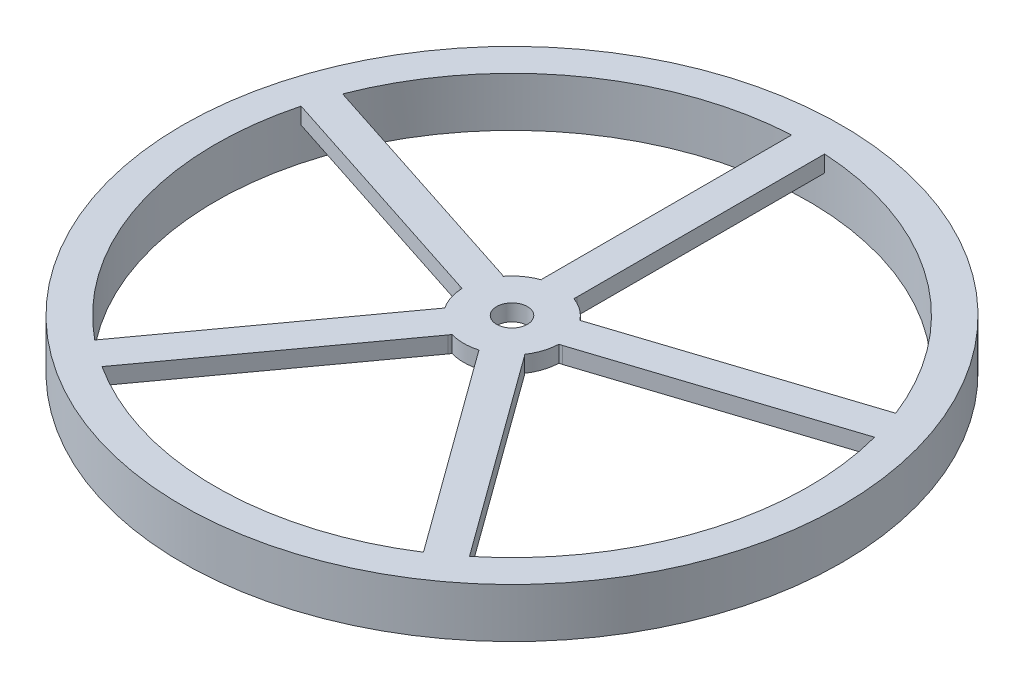
from build123d import *

# Parameters (mm, degrees)
SKETCH1_R           = 200
SKETCH1_R_2         = 180
EXTRUDE_THIN1_DEPTH = 30
SKETCH2_R           = 29.35
SKETCH2_R_2         = 9.35
EXTRUDE_THIN2_DEPTH = 10
BOSS_EXTRUDE1_DEPTH = 10
CIRPATTERN1_COUNT   = 5
SCALE3_SCALE        = 0.75


with BuildPart() as part:
    # Sketch1 → Extrude-Thin1 (new body)
    with BuildSketch(Plane(origin=(0, 0, 0), x_dir=(1, 0, 0), z_dir=(0, 1, 0))):
        Circle(SKETCH1_R)
        Circle(SKETCH1_R_2, mode=Mode.SUBTRACT)
    extrude(amount=EXTRUDE_THIN1_DEPTH)



with BuildPart() as body_2:
    # Sketch2 → Extrude-Thin2 (new body)
    with BuildSketch(Plane(origin=(0, 30, 0), x_dir=(1, 0, 0), z_dir=(0, 1, 0))):
        Circle(SKETCH2_R)
        Circle(SKETCH2_R_2, mode=Mode.SUBTRACT)
    extrude(amount=-EXTRUDE_THIN2_DEPTH)


with BuildPart() as part_1:
    add(part.part)

    add(body_2.part)  # Boss-Extrude1 merges body 2
    # Sketch3 → Boss-Extrude1 (add)
    with BuildSketch(Plane(origin=(0, 30, 0), x_dir=(1, 0, 0), z_dir=(0, 1, 0))):
        with BuildLine():
            Line((10, 29.35), (10, 180))
            ThreePointArc((10, 180), (0, 190), (-10, 180))
            Line((-10, 180), (-10, 29.35))
            ThreePointArc((-10, 29.35), (0, 19.35), (10, 29.35))
        make_face()
    boss_extrude1 = extrude(amount=-BOSS_EXTRUDE1_DEPTH)

    # CirPattern1: Boss-Extrude1 ×5 about axis
    cirpattern1_axis = Axis((0, 0, 0), (0, 1, 0))
    for i in range(1, CIRPATTERN1_COUNT):
        add(boss_extrude1.rotate(cirpattern1_axis, i * 360 / CIRPATTERN1_COUNT))


with BuildPart() as part_2:
    # Scale3: scaled about (0, 16.967452181, 0)
    add(part_1.part.scale(SCALE3_SCALE).moved(Location((0, 4.241863045, 0))))


solid = part_2.part
